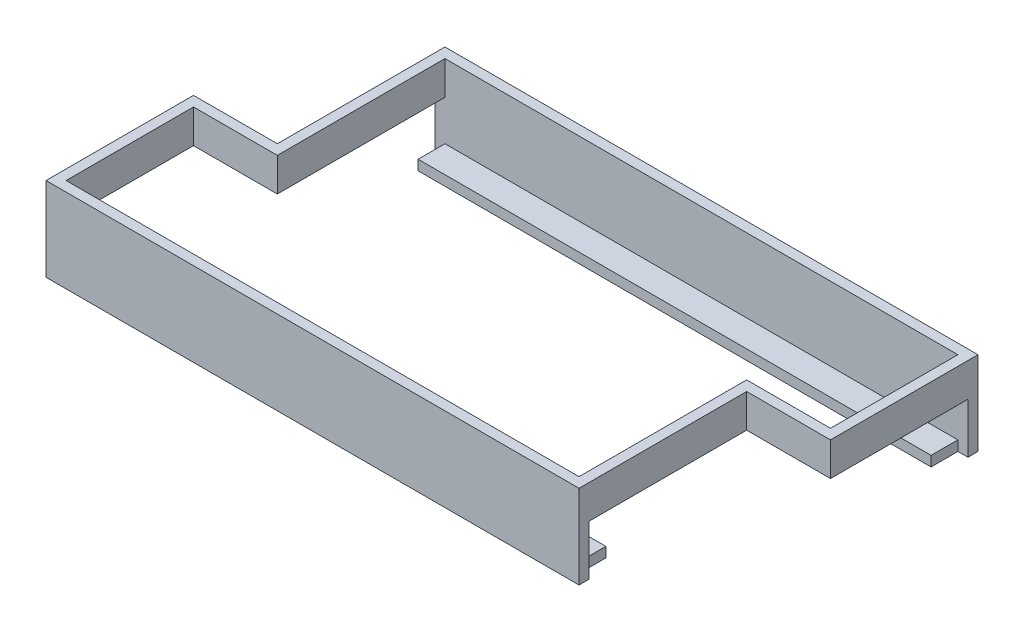
from build123d import *

# Parameters (mm, degrees)
BOSS_EXTRUDE1_DEPTH = 3
BOSS_EXTRUDE2_DEPTH = 22
SKETCH3_W           = 88
SKETCH3_H           = 19.19179848
CUT_EXTRUDE1_DEPTH  = 208
SKETCH5_W           = 153
SKETCH5_H           = 8
BOSS_EXTRUDE3_DEPTH = 3


with BuildPart() as part:
    # Sketch1 → Boss-Extrude1 (new body)
    with BuildSketch(Plane(origin=(0, 0, 0), x_dir=(1, 0, 0), z_dir=(0, 1, 0))):
        Polygon((-92, -3), (-92, -47), (-67, -47), (67, -47), (67, 3), (92, 3), (92, 47), (-67, 47), (-67, -3), align=None)
    extrude(amount=BOSS_EXTRUDE1_DEPTH)

    # Sketch2 → Boss-Extrude2 (add)
    with BuildSketch(Plane(origin=(0, 3, 0), x_dir=(1, 0, 0), z_dir=(0, 1, 0))):
        Polygon((92, 3), (92, 47), (-67, 47), (-67, -3), (-92, -3), (-92, -47), (67, -47), (67, 3), align=None)
        Polygon((-64, 44), (-64, -6), (-89, -6), (-89, -44), (64, -44), (64, 6), (89, 6), (89, 44), align=None, mode=Mode.SUBTRACT)
    extrude(amount=BOSS_EXTRUDE2_DEPTH)

    # Sketch3 → Cut-Extrude1 (cut)
    with BuildSketch(Plane(origin=(92, 0, 0), x_dir=(0, 0, -1), z_dir=(1, 0, 0))):
        with Locations((0, 5.40410076)):
            Rectangle(SKETCH3_W, SKETCH3_H)
    extrude(amount=-CUT_EXTRUDE1_DEPTH, mode=Mode.SUBTRACT)

    # Sketch5 → Boss-Extrude3 (add)
    with BuildSketch(Plane.XZ):
        with Locations((-12.5, 40)):
            Rectangle(SKETCH5_W, SKETCH5_H)
        with Locations((12.5, -40)):
            Rectangle(SKETCH5_W, SKETCH5_H)
    extrude(amount=-BOSS_EXTRUDE3_DEPTH)


solid = part.part
